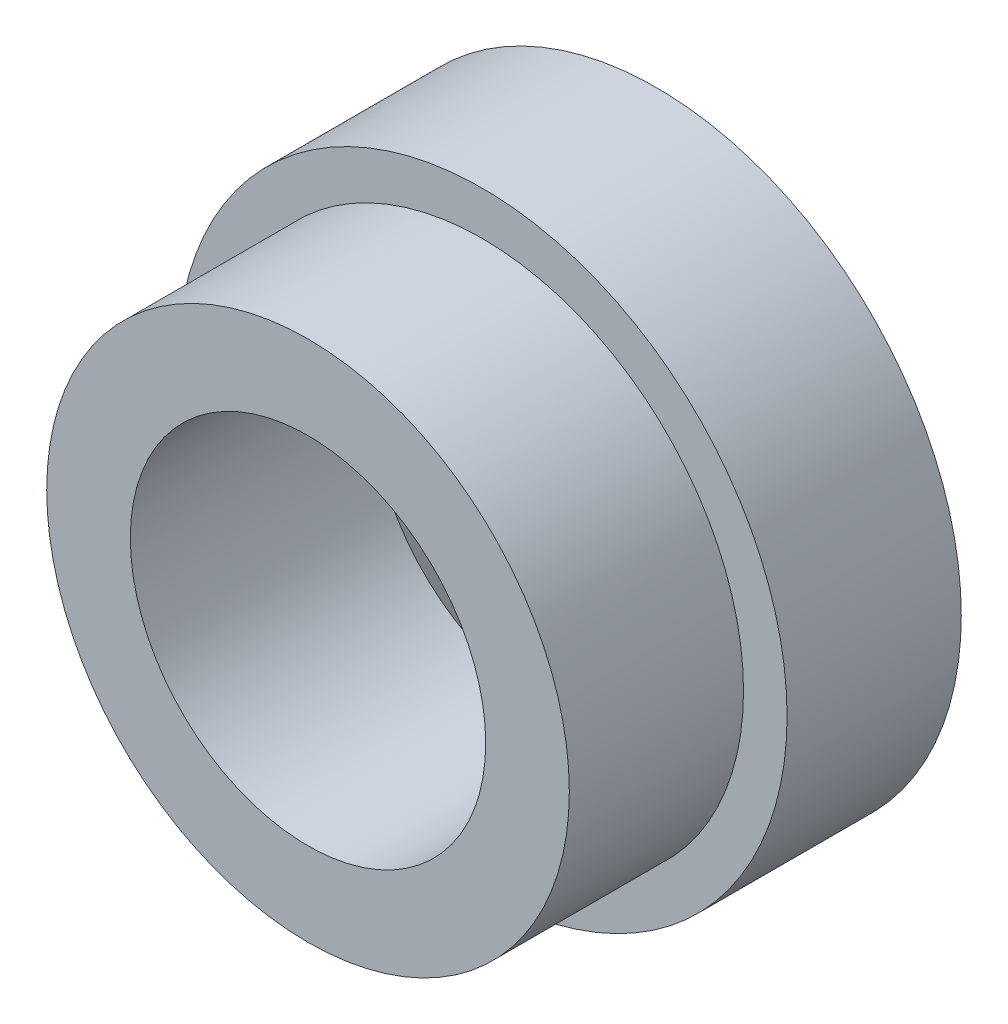
from build123d import *

# Parameters (mm, degrees)
SKETCH1_R                                           = 5.55625
BOSS_EXTRUDE1_DEPTH                                 = 3.175
SKETCH2_R                                           = 4.7625
BOSS_EXTRUDE2_DEPTH                                 = 3.175
CSK_FOR_1_4_FLAT_HEAD_MACHINE_SCREW_100_D           = 6.477
CSK_FOR_1_4_FLAT_HEAD_MACHINE_SCREW_100_CSINK_D     = 11.1125
CSK_FOR_1_4_FLAT_HEAD_MACHINE_SCREW_100_CSINK_ANGLE = 100


with BuildPart() as part:
    # Sketch1 → Boss-Extrude1 (new body)
    with BuildSketch(Plane.XY):
        Circle(SKETCH1_R)
    extrude(amount=BOSS_EXTRUDE1_DEPTH)

    # Sketch2 → Boss-Extrude2 (add)
    with BuildSketch(Plane.XY.offset(3.175)):
        Circle(SKETCH2_R)
    extrude(amount=BOSS_EXTRUDE2_DEPTH)

    # CSK for 1/4 Flat Head Machine Screw (100)1 (through all)
    with Locations(Plane(origin=(0, 0, 0), x_dir=(-1, 0, 0), z_dir=(0, 0, -1))):
        with Locations((0, 0)):
            CounterSinkHole(CSK_FOR_1_4_FLAT_HEAD_MACHINE_SCREW_100_D / 2, CSK_FOR_1_4_FLAT_HEAD_MACHINE_SCREW_100_CSINK_D / 2, counter_sink_angle=CSK_FOR_1_4_FLAT_HEAD_MACHINE_SCREW_100_CSINK_ANGLE)


solid = part.part
